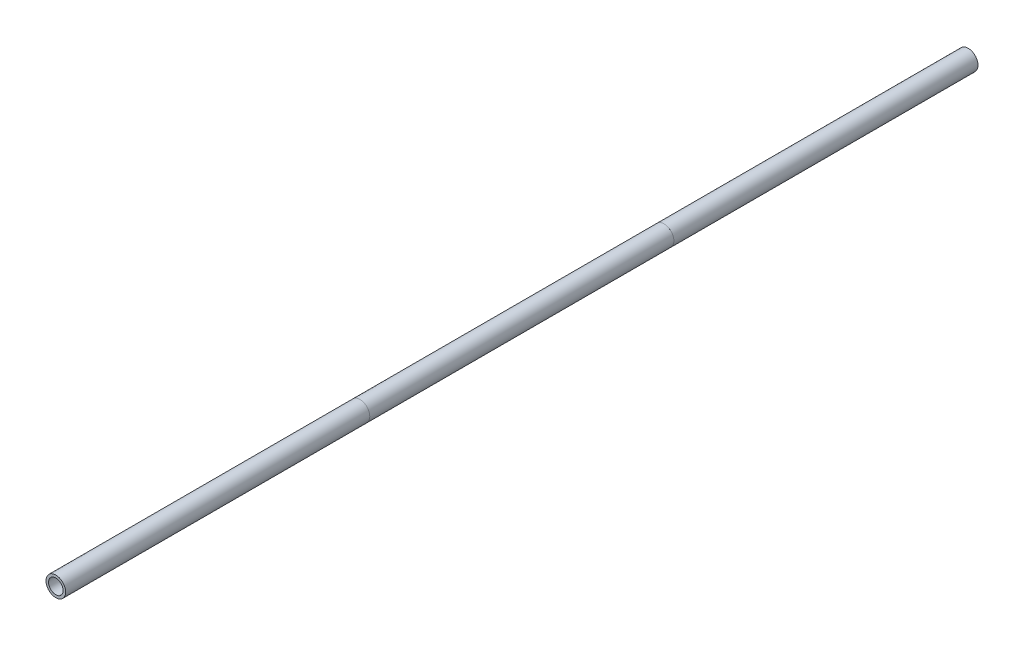
from build123d import *

# Parameters (mm, degrees)
SKETCH1_R           = 10.668
SKETCH1_R_2         = 7.8994
EXTRUDE_THIN1_DEPTH = 165
SKETCH2_R           = 10.668
SKETCH2_R_2         = 7.8994
BOSS_EXTRUDE2_DEPTH = 330
SKETCH3_R           = 10.668
SKETCH3_R_2         = 7.8994
BOSS_EXTRUDE3_DEPTH = 330


with BuildPart() as part:
    # Sketch1 → Extrude-Thin1 (new, symmetric)
    with BuildSketch(Plane.XY):
        Circle(SKETCH1_R)
        Circle(SKETCH1_R_2, mode=Mode.SUBTRACT)
    extrude(amount=EXTRUDE_THIN1_DEPTH, both=True)


with BuildPart() as body_2:
    # Sketch2 → Boss-Extrude2 (new body)
    with BuildSketch(Plane.XY.offset(165)):
        Circle(SKETCH2_R)
        Circle(SKETCH2_R_2, mode=Mode.SUBTRACT)
    extrude(amount=BOSS_EXTRUDE2_DEPTH)


with BuildPart() as body_3:
    # Sketch3 → Boss-Extrude3 (new body)
    with BuildSketch(Plane(origin=(0, 0, -165), x_dir=(-1, 0, 0), z_dir=(0, 0, -1))):
        Circle(SKETCH3_R)
        Circle(SKETCH3_R_2, mode=Mode.SUBTRACT)
    extrude(amount=BOSS_EXTRUDE3_DEPTH)


solid = Compound([part.part, body_2.part, body_3.part])
